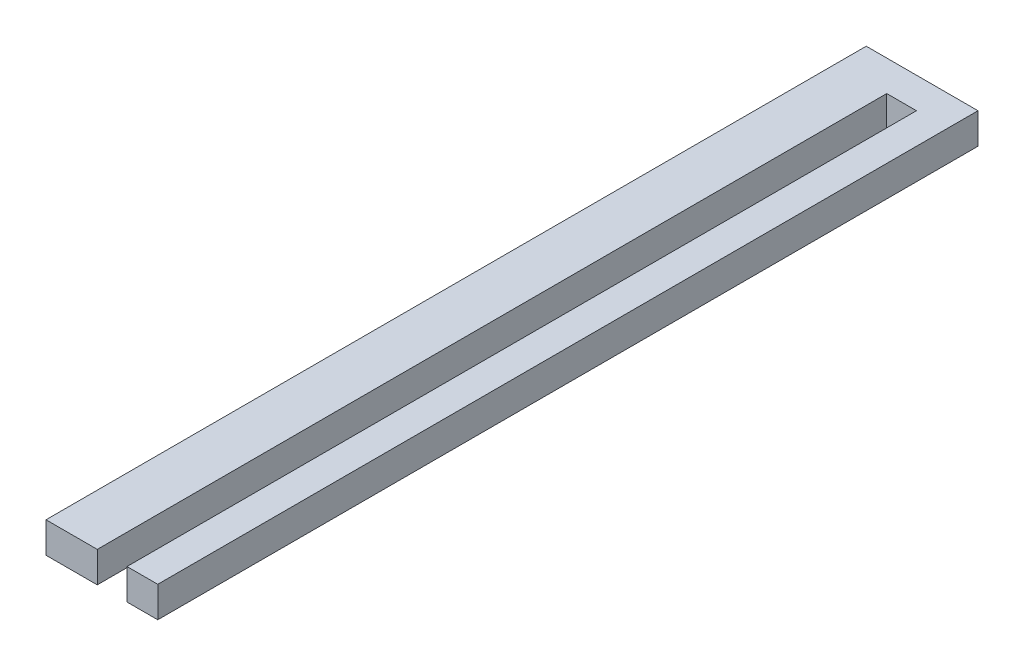
from build123d import *

# Parameters (mm, degrees)
EXTRUDE_1_DEPTH = 3


with BuildPart() as part:
    # 草图1 → 凸台-拉伸1 (new body)
    with BuildSketch(Plane(origin=(0, 0, 0), x_dir=(1, 0, 0), z_dir=(0, 1, 0))):
        Polygon((0, 0), (0, 80), (10.9, 80), (10.9, 0), (7.9, 0), (7.9, 77), (5, 77), (5, 0), align=None)
    extrude(amount=EXTRUDE_1_DEPTH)


solid = part.part
